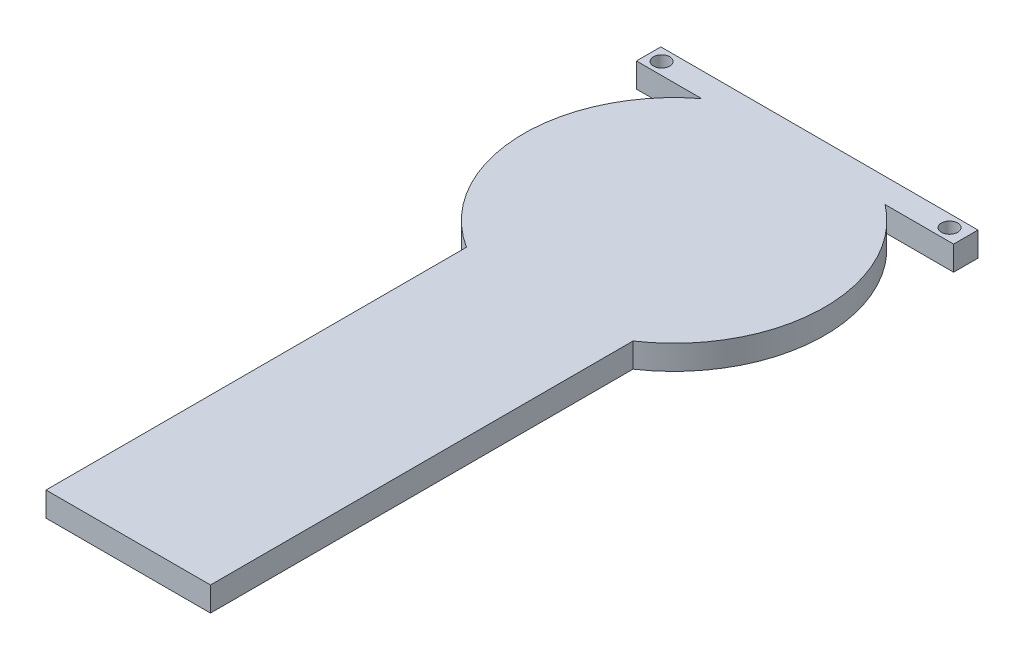
from build123d import *

# Parameters (mm, degrees)
SKETCH1_R           = 18.5
BOSS_EXTRUDE1_DEPTH = 3
SKETCH2_W           = 20.223748417
SKETCH2_H           = 1.96058716
BOSS_EXTRUDE2_DEPTH = 3
CUT_EXTRUDE1_DEPTH  = 3
SKETCH4_W           = 39
SKETCH4_H           = 3
BOSS_EXTRUDE3_DEPTH = 3
CUT_EXTRUDE2_DEPTH  = 3
SKETCH6_R           = 1
CUT_EXTRUDE3_DEPTH  = 3
SKETCH8_W           = 20.223748417
SKETCH8_H           = 50
BOSS_EXTRUDE4_DEPTH = 3


with BuildPart() as part:
    # Sketch1 → Boss-Extrude1 (new body)
    with BuildSketch(Plane(origin=(0, 0, 0), x_dir=(1, 0, 0), z_dir=(0, 1, 0))):
        with Locations(Location((0, 0, 0), (0, 0, 270))):
            Circle(SKETCH1_R)
    extrude(amount=BOSS_EXTRUDE1_DEPTH)

    # Sketch2 → Boss-Extrude2 (add)
    with BuildSketch(Plane.XZ):
        with Locations((0.2001438, 16.339729918)):
            Rectangle(SKETCH2_W, SKETCH2_H)
    extrude(amount=-BOSS_EXTRUDE2_DEPTH)

    # Sketch3 → Cut-Extrude1 (cut)
    with BuildSketch(Plane.XZ):
        with BuildLine():
            Line((6.501291106, 17.320023498), (-6.501291106, 17.320023498))
            ThreePointArc((-6.501291106, 17.320023498), (0, 18.5), (6.501291106, 17.320023498))
        make_face()
    extrude(amount=-CUT_EXTRUDE1_DEPTH, mode=Mode.SUBTRACT)

    # Sketch4 → Boss-Extrude3 (add)
    with BuildSketch(Plane.XZ):
        with Locations((0.200143799, -16.163843272)):
            Rectangle(SKETCH4_W, SKETCH4_H)
    extrude(amount=-BOSS_EXTRUDE3_DEPTH)

    # Sketch5 → Cut-Extrude2 (cut)
    with BuildSketch(Plane.XZ):
        with BuildLine():
            Line((5.498967254, -17.663843272), (-5.498967254, -17.663843272))
            ThreePointArc((-5.498967254, -17.663843272), (0, -18.5), (5.498967254, -17.663843272))
        make_face()
    extrude(amount=-CUT_EXTRUDE2_DEPTH, mode=Mode.SUBTRACT)

    # Sketch6 → Cut-Extrude3 (cut)
    with BuildSketch(Plane.XZ):
        with Locations(Location((17.700143799, -16.163843272, 0), (0, 0, 270))):
            Circle(SKETCH6_R)
        with Locations(Location((-17.700143799, -16.163843272, 0), (0, 0, 270))):
            Circle(SKETCH6_R)
    extrude(amount=-CUT_EXTRUDE3_DEPTH, mode=Mode.SUBTRACT)

    # Sketch8 → Boss-Extrude4 (add)
    with BuildSketch(Plane(origin=(0, 3, 0), x_dir=(1, 0, 0), z_dir=(0, 1, 0))):
        with Locations((0.2001438, -42.320023498)):
            Rectangle(SKETCH8_W, SKETCH8_H)
    extrude(amount=-BOSS_EXTRUDE4_DEPTH)


solid = part.part
